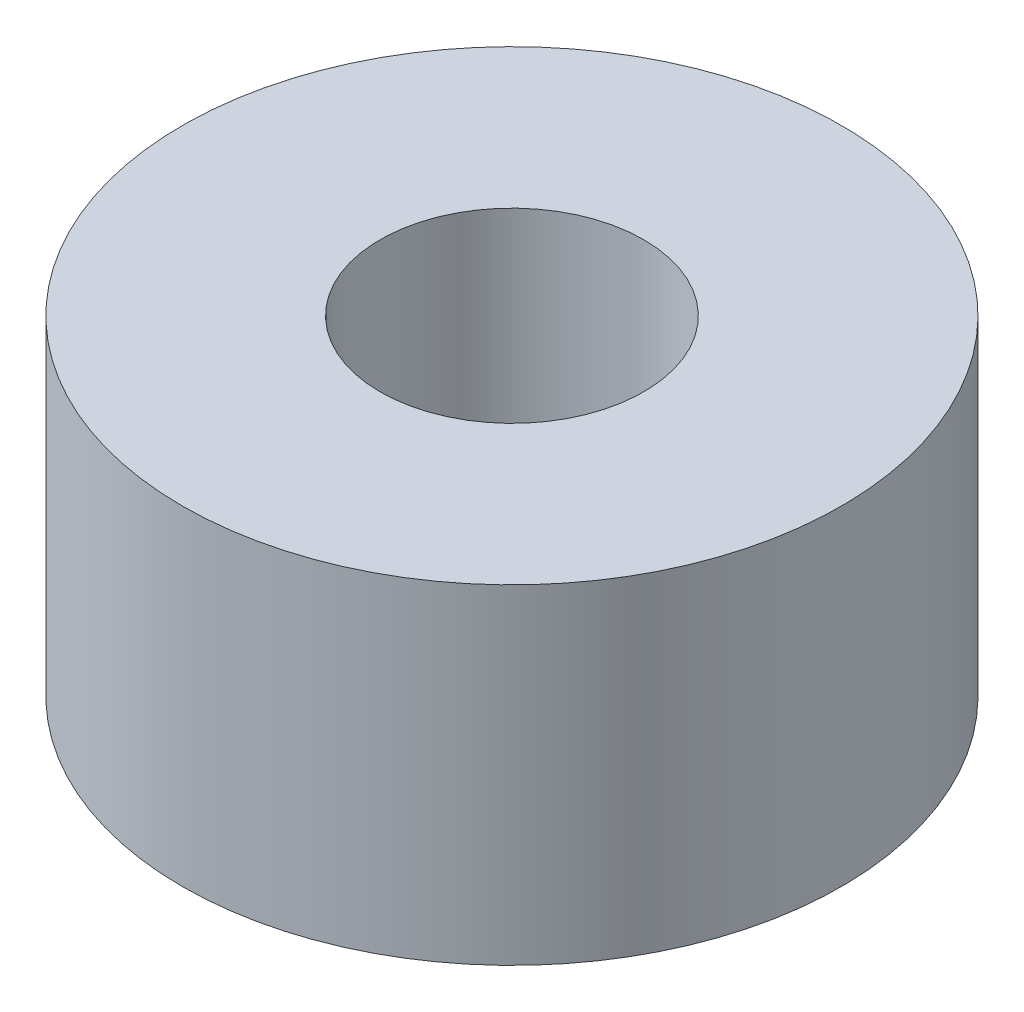
from build123d import *

# Parameters (mm, degrees)
SKETCH1_R           = 2.5
SKETCH1_R_2         = 1
BOSS_EXTRUDE1_DEPTH = 2.5


with BuildPart() as part:
    # Sketch1 → Boss-Extrude1 (new body)
    with BuildSketch(Plane(origin=(0, 0, 0), x_dir=(1, 0, 0), z_dir=(0, 1, 0))):
        with Locations(Location((0, 0, 0), (0, 0, 270))):
            Circle(SKETCH1_R)
        with Locations(Location((0, 0, 0), (0, 0, 270))):
            Circle(SKETCH1_R_2, mode=Mode.SUBTRACT)
    extrude(amount=BOSS_EXTRUDE1_DEPTH)


solid = part.part
